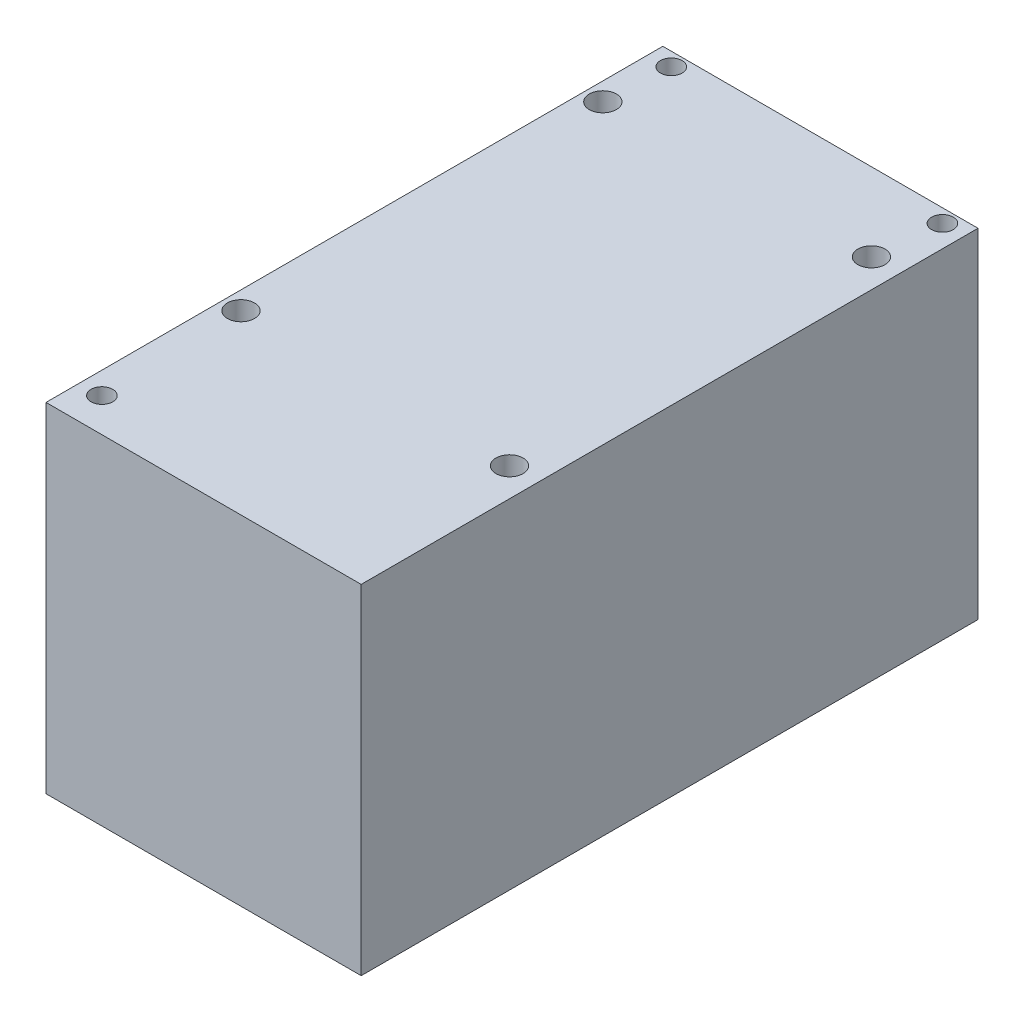
from build123d import *

# Parameters (mm, degrees)
SKETCH_1_W          = 46.5
SKETCH_1_H          = 91
SKETCH_1_R          = 1.6
EXTRUDE_1_DEPTH     = 50
HOLE_WIZARD_1_D     = 4
HOLE_WIZARD_2_D     = 4
HOLE_WIZARD_2_DEPTH = 100


with BuildPart() as part:
    # 草图1 → 凸台-拉伸1 (new body)
    with BuildSketch(Plane(origin=(0, 0, 0), x_dir=(1, 0, 0), z_dir=(0, 1, 0))):
        Rectangle(SKETCH_1_W, SKETCH_1_H)
        with Locations(Location((20, 43.5, 0), (0, 0, 270))):
            Circle(SKETCH_1_R, mode=Mode.SUBTRACT)
        with Locations(Location((-20, 43.5, 0), (0, 0, 90))):
            Circle(SKETCH_1_R, mode=Mode.SUBTRACT)
        with Locations(Location((-20, -40.5, 0), (0, 0, 270))):
            Circle(SKETCH_1_R, mode=Mode.SUBTRACT)
    extrude(amount=EXTRUDE_1_DEPTH)

    # 孔1 (through all)
    with Locations(Plane(origin=(0, 50, 0), x_dir=(1, 0, 0), z_dir=(0, 1, 0))):
        with Locations((19.042, -19.406)):
            Hole(HOLE_WIZARD_1_D / 2)

    # 孔2
    with Locations(Plane(origin=(0, 50, 0), x_dir=(1, 0, 0), z_dir=(0, 1, 0))):
        with Locations((19.042, 33.984), (-20.583, 33.984), (-20.583, -19.406)):
            Hole(HOLE_WIZARD_2_D / 2, depth=HOLE_WIZARD_2_DEPTH)


solid = part.part
